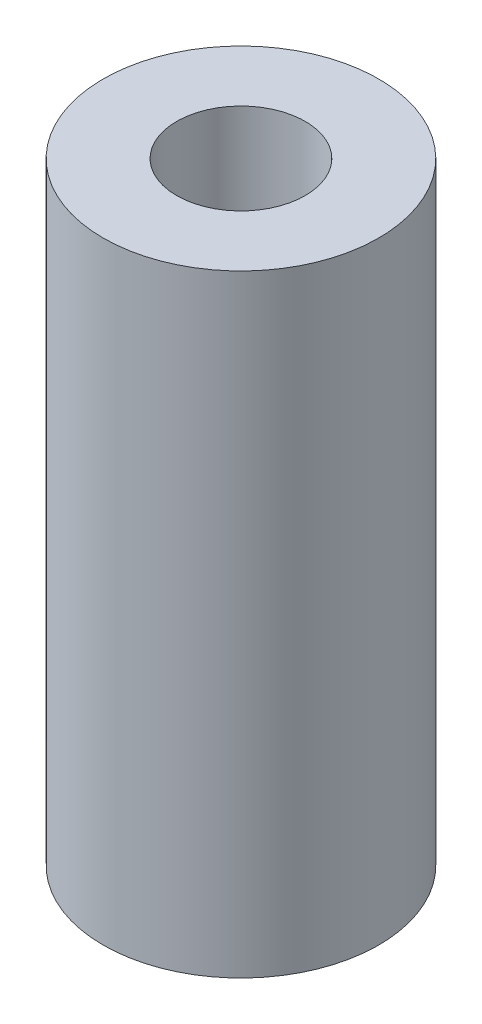
from build123d import *

# Parameters (mm, degrees)
SKETCH1_R           = 5.715
SKETCH1_R_2         = 2.667
BOSS_EXTRUDE1_DEPTH = 12.7


with BuildPart() as part:
    # Sketch1 → Boss-Extrude1 (new, symmetric)
    with BuildSketch(Plane(origin=(0, 0, 0), x_dir=(1, 0, 0), z_dir=(0, 1, 0))):
        with Locations(Location((0, 0, 0), (0, 0, 270))):
            Circle(SKETCH1_R)
        with Locations(Location((0, 0, 0), (0, 0, 270))):
            Circle(SKETCH1_R_2, mode=Mode.SUBTRACT)
    extrude(amount=BOSS_EXTRUDE1_DEPTH, both=True)


solid = part.part
